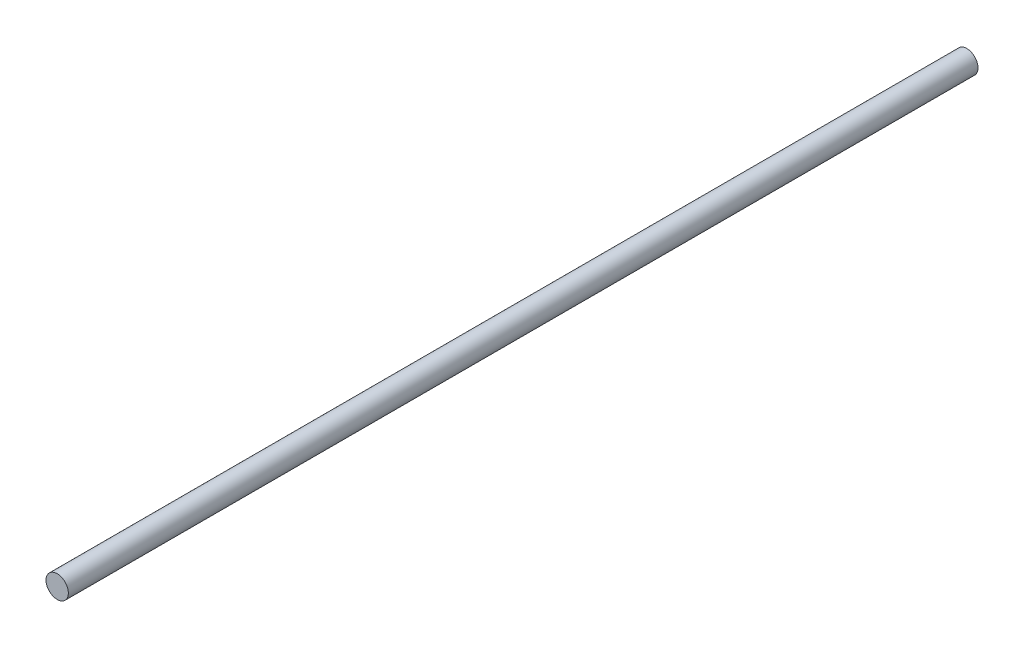
from build123d import *

# Parameters (mm, degrees)
SKETCH1_R           = 6
BOSS_EXTRUDE1_DEPTH = 488


with BuildPart() as part:
    # Sketch1 → Boss-Extrude1 (new body)
    with BuildSketch(Plane.XY):
        with Locations(Location((0, 0, 0), (0, 0, 180))):
            Circle(SKETCH1_R)
    extrude(amount=BOSS_EXTRUDE1_DEPTH)


solid = part.part
